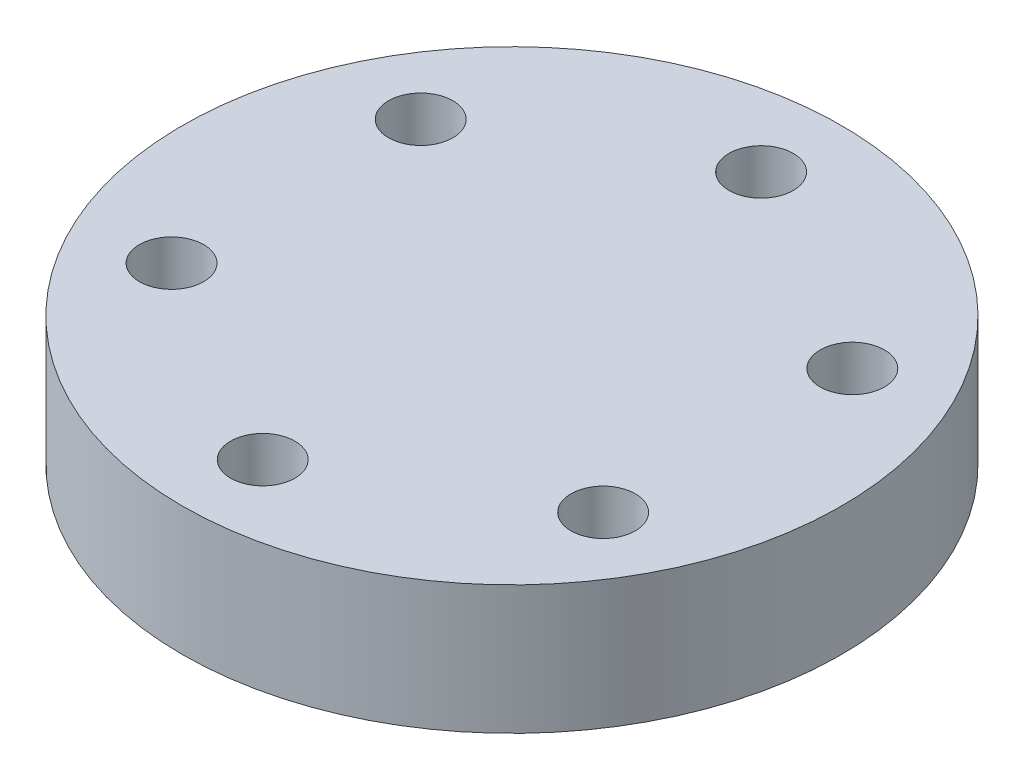
from build123d import *

# Parameters (mm, degrees)
SKETCH_1_R               = 20.5
EXTRUDE_1_DEPTH          = 8
CUT_EXTRUDE_1_REACH      = 32.075
SKETCH_2_R               = 2
PATTERN_CIRCULAR_1_COUNT = 6


with BuildPart() as part:
    # 草圖1 → 填料-伸長1 (new body)
    with BuildSketch(Plane(origin=(0, 0, 0), x_dir=(1, 0, 0), z_dir=(0, 1, 0))):
        with Locations(Location((0, 0, 0), (0, 0, 270))):
            Circle(SKETCH_1_R)
    extrude(amount=EXTRUDE_1_DEPTH)

    # 草圖2 → 除料-伸長1 (cut, up to next)
    with BuildSketch(Plane(origin=(0, 8, 0), x_dir=(1, 0, 0), z_dir=(0, 1, 0)), mode=Mode.PRIVATE) as cut_extrude_1_sk1:
        with Locations(Location((0, 15.5, 0), (0, 0, 270))):
            Circle(SKETCH_2_R)
    cut_extrude_1_tool1 = extrude(cut_extrude_1_sk1.sketch, amount=-CUT_EXTRUDE_1_REACH, mode=Mode.PRIVATE) & part.part
    cut_extrude_1 = cut_extrude_1_tool1.solids().sort_by_distance((0, 8, -15.5))[0]
    add(cut_extrude_1, mode=Mode.SUBTRACT)

    # 環狀複製排列1: 除料-伸長1 ×6 about axis
    pattern_circular_1_axis = Axis((0, 0, 0), (0, 1, 0))
    for i in range(1, PATTERN_CIRCULAR_1_COUNT):
        add(cut_extrude_1.rotate(pattern_circular_1_axis, i * 360 / PATTERN_CIRCULAR_1_COUNT), mode=Mode.SUBTRACT)


solid = part.part
